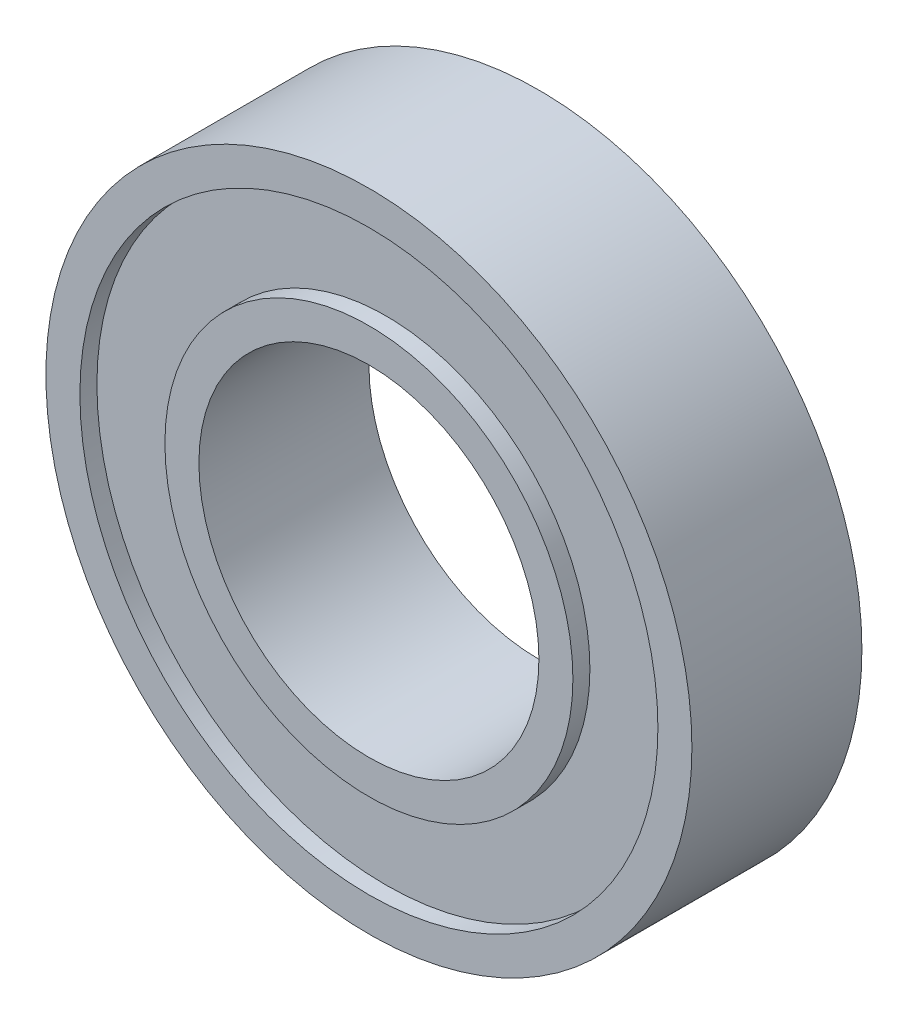
from build123d import *


with BuildPart() as part:
    # Sketch1 → Revolve1 (revolve)
    with BuildSketch(Plane(origin=(0, 0, 0), x_dir=(0, 0, -1), z_dir=(1, 0, 0)), mode=Mode.PRIVATE) as revolve1_sk:
        Polygon((-2.5, 6), (-2.5, 5), (2.5, 5), (2.5, 6), (2, 6), (2, 8.5), (2.5, 8.5), (2.5, 9.5), (-2.5, 9.5), (-2.5, 8.5), (-2, 8.5), (-2, 6), align=None)
    revolve(revolve1_sk.sketch.rotate(Axis((0, 0, 0), (0, 0, -1)), 90), axis=Axis((0, 0, 0), (0, 0, -1)))


solid = part.part
